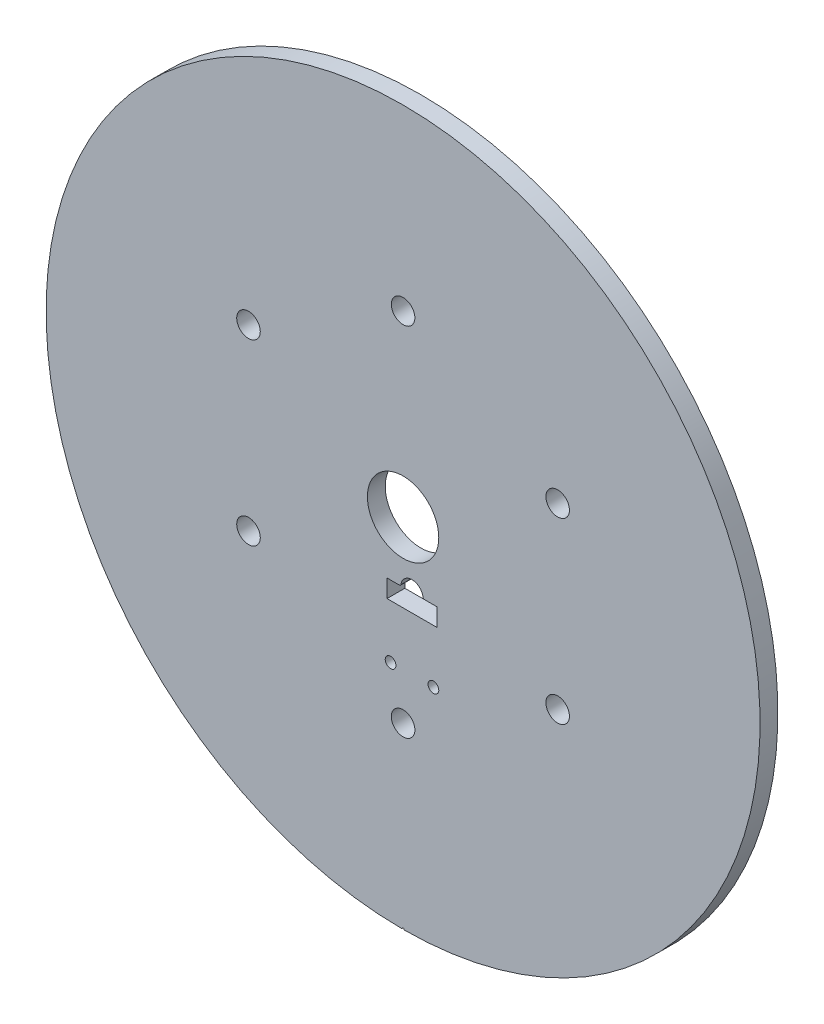
from build123d import *

# Parameters (mm, degrees)
SKETCH1_R                = 100
BOSS_EXTRUDE1_DEPTH      = 5
SKETCH4_R                = 3
CUT_EXTRUDE2_DEPTH       = 142.509716981
CIRPATTERN1_COUNT        = 6
M6_CLEARANCE_HOLE1_D     = 6.6
SKETCH7_W                = 14
SKETCH7_H                = 5
CUT_EXTRUDE3_DEPTH       = 142.509716981
SKETCH8_R                = 1
SKETCH8_R_2              = 3.1
CUT_EXTRUDE4_DEPTH       = 142.509716981
F_0000_CLEARANCE_HOLE3_D = 0.6604
FILLET1_R                = 0.5
SKETCH20_R               = 1.5
CUT_EXTRUDE6_DEPTH       = 142.509716981
SKETCH21_R               = 10
CUT_EXTRUDE9_DEPTH       = 142.509716981


with BuildPart() as part:
    # Sketch1 → Boss-Extrude1 (new body)
    with BuildSketch(Plane.XY):
        Circle(SKETCH1_R)
    extrude(amount=BOSS_EXTRUDE1_DEPTH)

    # Sketch4 → Cut-Extrude2 (cut, through all)
    with BuildSketch(Plane.XY):
        with Locations((0, 50)):
            Circle(SKETCH4_R)
    cut_extrude2 = extrude(amount=CUT_EXTRUDE2_DEPTH, mode=Mode.SUBTRACT)

    # CirPattern1: Cut-Extrude2 ×6 about axis
    cirpattern1_axis = Axis((0, 0, 0), (0, 0, 1))
    for i in range(1, CIRPATTERN1_COUNT):
        add(cut_extrude2.rotate(cirpattern1_axis, i * 360 / CIRPATTERN1_COUNT), mode=Mode.SUBTRACT)

    # M6 Clearance Hole1 (through all)
    with Locations(Plane.XY.offset(5)):
        with Locations((0, 50), (43.301270189, 25), (43.301270189, -25), (0, -50), (-43.301270189, -25), (-43.301270189, 25)):
            Hole(M6_CLEARANCE_HOLE1_D / 2)

    # Sketch7 → Cut-Extrude3 (cut, through all)
    with BuildSketch(Plane.XY):
        with Locations((2.5, -19.5)):
            Rectangle(SKETCH7_W, SKETCH7_H)
    extrude(amount=CUT_EXTRUDE3_DEPTH, mode=Mode.SUBTRACT)

    # Sketch8 → Cut-Extrude4 (cut, through all)
    with BuildSketch(Plane(origin=(0, 0, 0), x_dir=(-1, 0, 0), z_dir=(0, 0, -1))):
        with Locations((-2.5, 4)):
            Circle(SKETCH8_R)
        with Locations((-2.5, -17)):
            Circle(SKETCH8_R_2)
    extrude(amount=-CUT_EXTRUDE4_DEPTH, mode=Mode.SUBTRACT)

    # #0000 Clearance Hole3 (through all)
    with Locations(Plane(origin=(0, 0, 0), x_dir=(-1, 0, 0), z_dir=(0, 0, -1))):
        with Locations((-2.5, 4), (0, 0), (0, -100)):
            Hole(F_0000_CLEARANCE_HOLE3_D / 2)

    # Fillet1
    fillet1_edges = [part.edges().sort_by_distance(p)[0] for p in [
        (5.6, -17, 2.5),
        (-0.6, -17, 2.5),
    ]]
    fillet(fillet1_edges, radius=FILLET1_R)

    # Sketch20 → Cut-Extrude6 (cut, through all)
    with BuildSketch(Plane(origin=(0, 0, 0), x_dir=(-1, 0, 0), z_dir=(0, 0, -1))):
        with Locations((-8.5, -37)):
            Circle(SKETCH20_R)
        with Locations((3.5, -37)):
            Circle(SKETCH20_R)
    extrude(amount=-CUT_EXTRUDE6_DEPTH, mode=Mode.SUBTRACT)

    # Sketch21 → Cut-Extrude9 (cut, through all)
    with BuildSketch(Plane.XY):
        Circle(SKETCH21_R)
    extrude(amount=CUT_EXTRUDE9_DEPTH, mode=Mode.SUBTRACT)


solid = part.part
